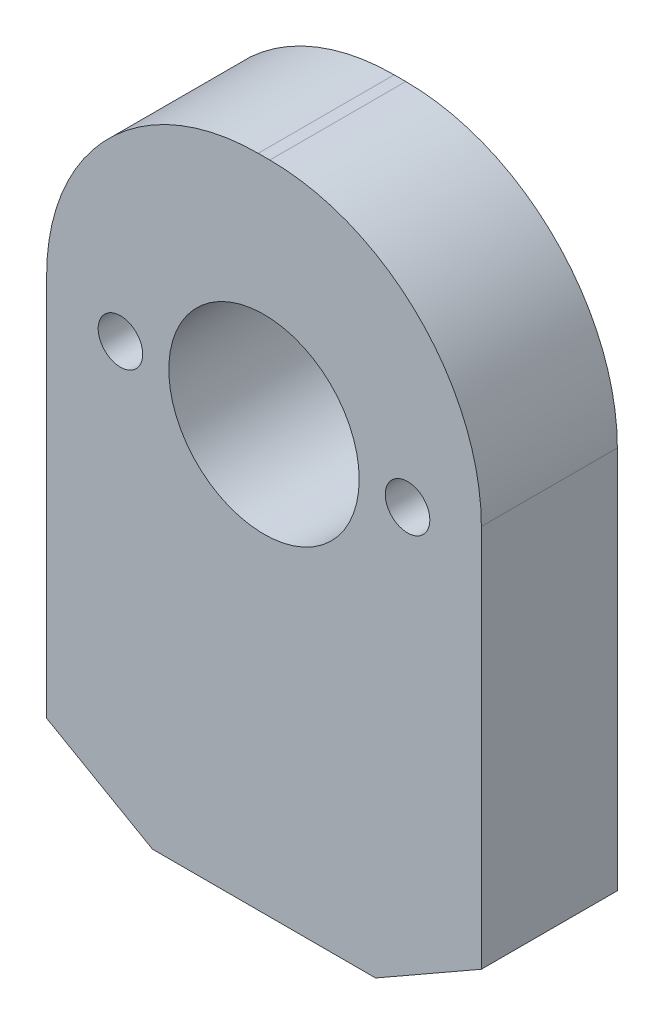
from build123d import *

# Parameters (mm, degrees)
SKETCH2_R           = 6.3
BOSS_EXTRUDE1_DEPTH = 9
SKETCH3_R           = 1.475
CUT_EXTRUDE1_DEPTH  = 4


with BuildPart() as part:
    # Sketch2 → Boss-Extrude1 (new body)
    with BuildSketch(Plane.XY):
        with BuildLine():
            Line((0, 4), (7, 0))
            Line((7, 0), (21.77, 0))
            Line((21.77, 0), (28.77, 4))
            Line((28.77, 4), (28.77, 29.38))
            ThreePointArc((28.77, 29.38), (24.669494937, 39.279494937), (14.77, 43.38))
            Line((14.77, 43.38), (14, 43.38))
            ThreePointArc((14, 43.38), (4.100505063, 39.279494937), (0, 29.38))
            Line((0, 29.38), (0, 4))
        make_face()
        with Locations((14.385, 28.04)):
            Circle(SKETCH2_R, mode=Mode.SUBTRACT)
    extrude(amount=BOSS_EXTRUDE1_DEPTH)

    # Sketch3 → Cut-Extrude1 (cut)
    with BuildSketch(Plane.XY.offset(9)):
        with Locations((4.885, 28.04)):
            Circle(SKETCH3_R)
        with Locations((23.885, 28.04)):
            Circle(SKETCH3_R)
    extrude(amount=-CUT_EXTRUDE1_DEPTH, mode=Mode.SUBTRACT)


solid = part.part
